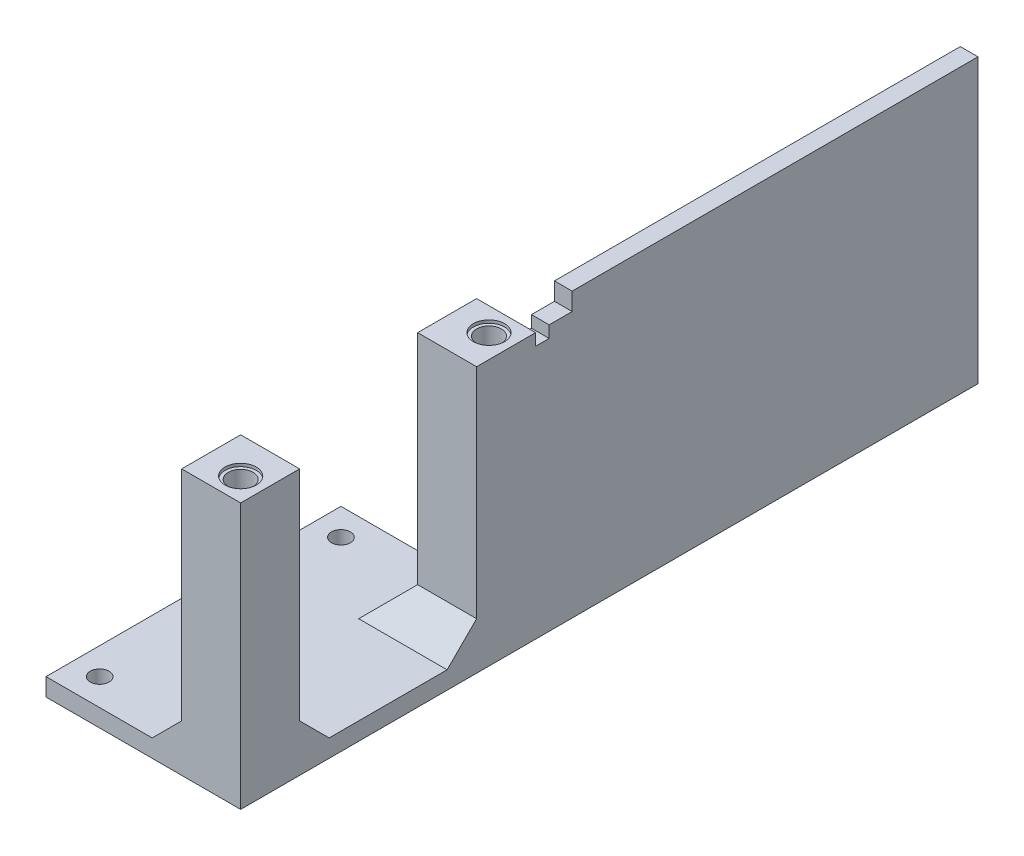
from build123d import *

# Parameters (mm, degrees)
SKETCH1_R           = 1.6
BOSS_EXTRUDE1_DEPTH = 3
SKETCH2_W           = 10
SKETCH2_H           = 10
BOSS_EXTRUDE2_DEPTH = 42
CHAMFER1_SIZE       = 5
SKETCH3_R           = 2.1
CUT_EXTRUDE1_DEPTH  = 52
SKETCH4_R           = 2.65
CUT_EXTRUDE2_DEPTH  = 0.5
SKETCH5_W           = 3
SKETCH5_H           = 43
BOSS_EXTRUDE3_DEPTH = 75
SKETCH6_W           = 3
SKETCH6_H           = 72.7
BOSS_EXTRUDE4_DEPTH = 2
SKETCH7_W           = 3
SKETCH7_H           = 68.8
BOSS_EXTRUDE5_DEPTH = 3


with BuildPart() as part:
    # Sketch1 → Boss-Extrude1 (new body)
    with BuildSketch(Plane(origin=(0, 0, 0), x_dir=(1, 0, 0), z_dir=(0, 1, 0))):
        Polygon((-6.512396694, 9.685950413), (1.487603306, 9.685950413), (26.487603306, 9.685950413), (26.487603306, -40.314049587), (1.487603306, -40.314049587), (-6.512396694, -40.314049587), align=None)
        with Locations(Location((-1.962396694, -35.764049587, 0), (0, 0, 270))):
            Circle(SKETCH1_R, mode=Mode.SUBTRACT)
        with Locations(Location((-1.962396694, 5.135950413, 0), (0, 0, 270))):
            Circle(SKETCH1_R, mode=Mode.SUBTRACT)
    extrude(amount=BOSS_EXTRUDE1_DEPTH)

    # Sketch2 → Boss-Extrude2 (add)
    with BuildSketch(Plane(origin=(0, 3, 0), x_dir=(1, 0, 0), z_dir=(0, 1, 0))):
        with Locations((21.487603306, -35.314049587)):
            Rectangle(SKETCH2_W, SKETCH2_H)
        with Locations((21.487603306, 4.685950413)):
            Rectangle(SKETCH2_W, SKETCH2_H)
    extrude(amount=BOSS_EXTRUDE2_DEPTH)

    # Chamfer1
    chamfer1_edges = [part.edges().sort_by_distance(p)[0] for p in [
        (21.487603306, 3, 30.314049587),
        (16.487603306, 3, 35.314049587),
        (16.487603306, 3, -4.685950413),
        (21.487603306, 3, 0.314049587),
    ]]
    chamfer(chamfer1_edges, length=CHAMFER1_SIZE)

    # Sketch3 → Cut-Extrude1 (cut)
    with BuildSketch(Plane(origin=(0, 45, 0), x_dir=(1, 0, 0), z_dir=(0, 1, 0))):
        with Locations(Location((22.537603306, -36.364049587, 0), (0, 0, 270))):
            Circle(SKETCH3_R)
        with Locations(Location((22.537603306, 5.735950413, 0), (0, 0, 270))):
            Circle(SKETCH3_R)
    extrude(amount=-CUT_EXTRUDE1_DEPTH, mode=Mode.SUBTRACT)

    # Sketch4 → Cut-Extrude2 (cut)
    with BuildSketch(Plane(origin=(0, 45, 0), x_dir=(1, 0, 0), z_dir=(0, 1, 0))):
        with Locations(Location((22.537603306, -36.364049587, 0), (0, 0, 270))):
            Circle(SKETCH4_R)
        with Locations(Location((22.537603306, 5.735950413, 0), (0, 0, 270))):
            Circle(SKETCH4_R)
    cut_extrude2 = extrude(amount=-CUT_EXTRUDE2_DEPTH, mode=Mode.SUBTRACT)

    # Mirror1: Cut-Extrude2 across plane
    add(cut_extrude2.mirror(Plane(origin=(0, 22.5, 0), x_dir=(0, 0, 1), z_dir=(0, -1, 0))), mode=Mode.SUBTRACT)

    # Sketch5 → Boss-Extrude3 (add)
    with BuildSketch(Plane(origin=(0, 0, -9.685950413), x_dir=(-1, 0, 0), z_dir=(0, 0, -1))):
        with Locations((-24.987603306, 21.5)):
            Rectangle(SKETCH5_W, SKETCH5_H)
    extrude(amount=BOSS_EXTRUDE3_DEPTH)

    # Sketch6 → Boss-Extrude4 (add)
    with BuildSketch(Plane(origin=(0, 43, 0), x_dir=(1, 0, 0), z_dir=(0, 1, 0))):
        with Locations((24.987603306, 48.335950413)):
            Rectangle(SKETCH6_W, SKETCH6_H)
    extrude(amount=BOSS_EXTRUDE4_DEPTH)

    # Sketch7 → Boss-Extrude5 (add)
    with BuildSketch(Plane(origin=(0, 45, 0), x_dir=(1, 0, 0), z_dir=(0, 1, 0))):
        with Locations((24.987603306, 50.285950413)):
            Rectangle(SKETCH7_W, SKETCH7_H)
    extrude(amount=BOSS_EXTRUDE5_DEPTH)


solid = part.part
